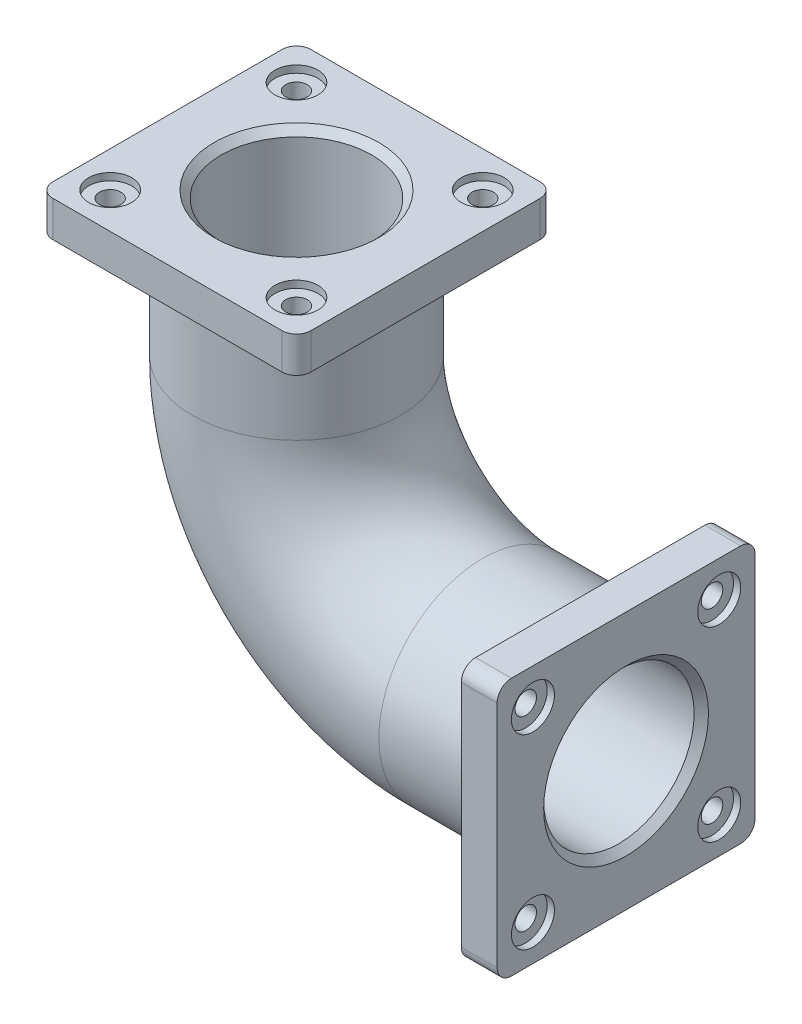
from build123d import *

# Parameters (mm, degrees)
SKETCH3_W           = 360
SKETCH3_H           = 360
SKETCH3_R           = 30
SKETCH3_R_2         = 105
BOSS_EXTRUDE1_DEPTH = 50
SKETCH3_3_R         = 30
SKETCH3_3_R_2       = 15
BOSS_EXTRUDE2_DEPTH = 40
SKETCH2_W           = 360
SKETCH2_H           = 360
SKETCH2_R           = 30
SKETCH2_R_2         = 105
BOSS_EXTRUDE3_DEPTH = 50
SKETCH2_3_R         = 30
SKETCH2_3_R_2       = 15
BOSS_EXTRUDE4_DEPTH = 40
SKETCH4_R           = 145
SKETCH5_R           = 105
CHAMFER1_SIZE       = 10
FILLET1_R           = 20
FILLET2_R           = 20


with BuildPart() as part:
    # Sketch3 → Boss-Extrude1 (new body)
    with BuildSketch(Plane(origin=(410, 0, 0), x_dir=(0, 0, -1), z_dir=(1, 0, 0))):
        Rectangle(SKETCH3_W, SKETCH3_H)
        with Locations((-130, -130)):
            Circle(SKETCH3_R, mode=Mode.SUBTRACT)
        with Locations((130, -130)):
            Circle(SKETCH3_R, mode=Mode.SUBTRACT)
        with Locations((-130, 130)):
            Circle(SKETCH3_R, mode=Mode.SUBTRACT)
        with Locations((130, 130)):
            Circle(SKETCH3_R, mode=Mode.SUBTRACT)
        Circle(SKETCH3_R_2, mode=Mode.SUBTRACT)
    extrude(amount=BOSS_EXTRUDE1_DEPTH)

    # Sketch3<3> → Boss-Extrude2 (add)
    # profile 1 of 4: a face of its own
    with BuildSketch(Plane(origin=(410, 0, 0), x_dir=(0, 0, -1), z_dir=(1, 0, 0))):
        with Locations((130, 130)):
            Circle(SKETCH3_3_R)
        with Locations((130, 130)):
            Circle(SKETCH3_3_R_2, mode=Mode.SUBTRACT)
    # profile 2 of 4: a face of its own
    with BuildSketch(Plane(origin=(410, 0, 0), x_dir=(0, 0, -1), z_dir=(1, 0, 0))):
        with Locations((130, -130)):
            Circle(SKETCH3_3_R)
        with Locations((130, -130)):
            Circle(SKETCH3_3_R_2, mode=Mode.SUBTRACT)
    # profile 3 of 4: a face of its own
    with BuildSketch(Plane(origin=(410, 0, 0), x_dir=(0, 0, -1), z_dir=(1, 0, 0))):
        with Locations((-130, -130)):
            Circle(SKETCH3_3_R)
        with Locations((-130, -130)):
            Circle(SKETCH3_3_R_2, mode=Mode.SUBTRACT)
    # profile 4 of 4: a face of its own
    with BuildSketch(Plane(origin=(410, 0, 0), x_dir=(0, 0, -1), z_dir=(1, 0, 0))):
        with Locations((-130, 130)):
            Circle(SKETCH3_3_R)
        with Locations((-130, 130)):
            Circle(SKETCH3_3_R_2, mode=Mode.SUBTRACT)
    extrude(amount=BOSS_EXTRUDE2_DEPTH)



with BuildPart() as body_2:
    # Sketch2 → Boss-Extrude3 (new body)
    with BuildSketch(Plane(origin=(0, 410, 0), x_dir=(1, 0, 0), z_dir=(0, 1, 0))):
        Rectangle(SKETCH2_W, SKETCH2_H)
        with Locations((-130, -130)):
            Circle(SKETCH2_R, mode=Mode.SUBTRACT)
        with Locations((130, -130)):
            Circle(SKETCH2_R, mode=Mode.SUBTRACT)
        with Locations((-130, 130)):
            Circle(SKETCH2_R, mode=Mode.SUBTRACT)
        with Locations((130, 130)):
            Circle(SKETCH2_R, mode=Mode.SUBTRACT)
        Circle(SKETCH2_R_2, mode=Mode.SUBTRACT)
    extrude(amount=BOSS_EXTRUDE3_DEPTH)

    # Sketch2<3> → Boss-Extrude4 (add)
    # profile 1 of 4: a face of its own
    with BuildSketch(Plane(origin=(0, 410, 0), x_dir=(1, 0, 0), z_dir=(0, 1, 0))):
        with Locations((130, 130)):
            Circle(SKETCH2_3_R)
        with Locations((130, 130)):
            Circle(SKETCH2_3_R_2, mode=Mode.SUBTRACT)
    # profile 2 of 4: a face of its own
    with BuildSketch(Plane(origin=(0, 410, 0), x_dir=(1, 0, 0), z_dir=(0, 1, 0))):
        with Locations((130, -130)):
            Circle(SKETCH2_3_R)
        with Locations((130, -130)):
            Circle(SKETCH2_3_R_2, mode=Mode.SUBTRACT)
    # profile 3 of 4: a face of its own
    with BuildSketch(Plane(origin=(0, 410, 0), x_dir=(1, 0, 0), z_dir=(0, 1, 0))):
        with Locations((-130, -130)):
            Circle(SKETCH2_3_R)
        with Locations((-130, -130)):
            Circle(SKETCH2_3_R_2, mode=Mode.SUBTRACT)
    # profile 4 of 4: a face of its own
    with BuildSketch(Plane(origin=(0, 410, 0), x_dir=(1, 0, 0), z_dir=(0, 1, 0))):
        with Locations((-130, 130)):
            Circle(SKETCH2_3_R)
        with Locations((-130, 130)):
            Circle(SKETCH2_3_R_2, mode=Mode.SUBTRACT)
    extrude(amount=BOSS_EXTRUDE4_DEPTH)


with BuildPart() as part_1:
    add(part.part)

    add(body_2.part)  # Sweep1 merges body 2
    # Sweep1: sweep along a path in Sketch1
    with BuildLine(Plane.XY) as sweep1_path:
        Line((0, 410), (0, 260))
        ThreePointArc((0, 260), (76.152236891, 76.152236891), (260, 0))
        Line((260, 0), (410, 0))
    # Sketch4 → Sweep1 (sweep)
    with BuildSketch(Plane.ZY.offset(-410)):
        Circle(SKETCH4_R)
    sweep(path=sweep1_path.line)

    # Cut-Sweep2: sweep along a path in Sketch6
    with BuildLine(Plane.XY) as cut_sweep2_path:
        Line((0, 410), (0, 260))
        ThreePointArc((0, 260), (76.152236891, 76.152236891), (260, 0))
        Line((260, 0), (410, 0))
    # Sketch5 → Cut-Sweep2 (sweep, cut)
    with BuildSketch(Plane(origin=(0, 410, 0), x_dir=(1, 0, 0), z_dir=(0, 1, 0))):
        Circle(SKETCH5_R)
    sweep(path=cut_sweep2_path.line, mode=Mode.SUBTRACT)

    # Chamfer1
    chamfer1_edges = [part_1.edges().sort_by_distance(p)[0] for p in [
        (460, 0, 105),
        (-105, 460, 0),
    ]]
    chamfer(chamfer1_edges, length=CHAMFER1_SIZE)

    # Fillet1
    fillet1_edges = [part_1.edges().sort_by_distance(p)[0] for p in [
        (-180, 435, 180),
    ]]
    fillet(fillet1_edges, radius=FILLET1_R)

    # Fillet2
    fillet2_edges = [part_1.edges().sort_by_distance(p)[0] for p in [
        (435, 180, 180),
        (435, -180, 180),
        (435, -180, -180),
        (435, 180, -180),
        (-180, 435, -180),
        (180, 435, -180),
        (180, 435, 180),
    ]]
    fillet(fillet2_edges, radius=FILLET2_R)


solid = part_1.part
